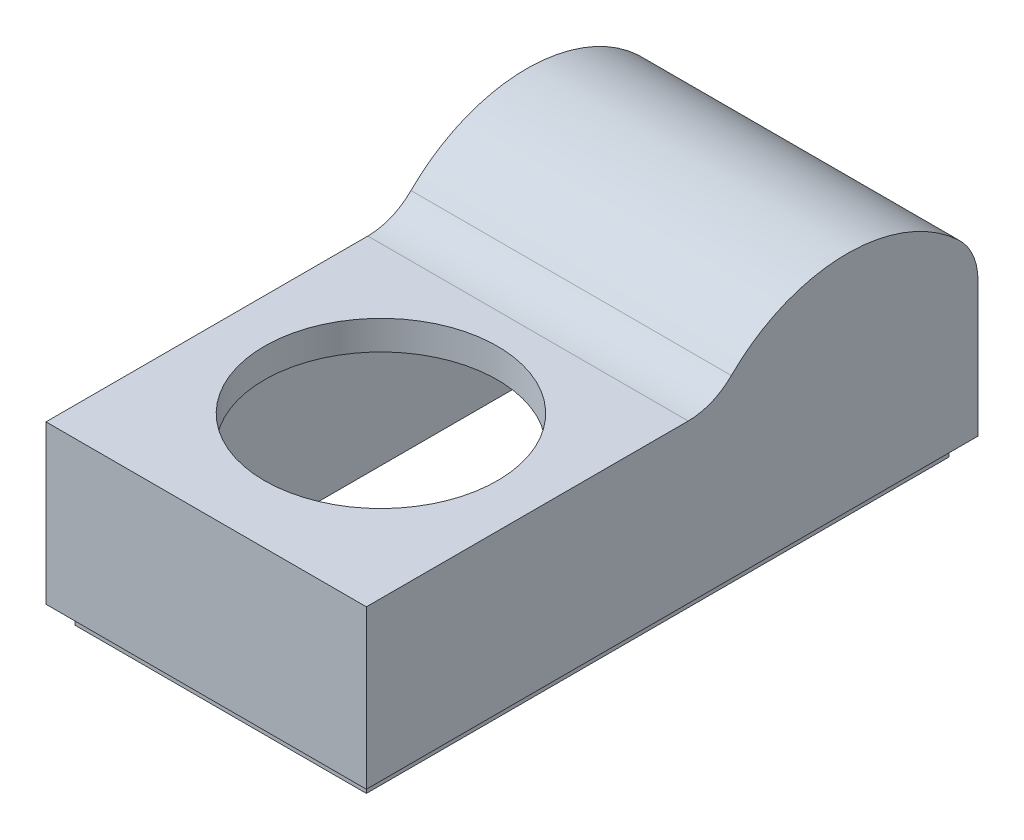
from build123d import *

# Parameters (mm, degrees)
SKETCH1_W           = 27.94
SKETCH1_H           = 53.34
BOSS_EXTRUDE1_DEPTH = 9.74725
CUT_EXTRUDE1_DEPTH  = 27.94
FILLET1_R           = 5.334
FILLET2_R           = 5.334
SHELL1_T            = -2.54
SKETCH3_R           = 10.16
CUT_EXTRUDE2_DEPTH  = 24.13
SKETCH5_W           = 10.795
SKETCH5_H           = 1.5875
CUT_EXTRUDE3_DEPTH  = 2.54
BOSS_EXTRUDE2_DEPTH = 1.5875


with BuildPart() as part:
    # Sketch1 → Boss-Extrude1 (new, symmetric)
    with BuildSketch(Plane(origin=(0, 0, 0), x_dir=(1, 0, 0), z_dir=(0, 1, 0))):
        Rectangle(SKETCH1_W, SKETCH1_H)
    extrude(amount=BOSS_EXTRUDE1_DEPTH, both=True)

    # Sketch2 → Cut-Extrude1 (cut)
    with BuildSketch(Plane(origin=(13.97, 0, 0), x_dir=(0, 0, -1), z_dir=(1, 0, 0))):
        with BuildLine():
            Line((-26.67, 9.74725), (-26.67, 4.03225))
            Line((-26.67, 4.03225), (3.81, 4.03225))
            ThreePointArc((3.81, 4.03225), (8.850435754, 8.238878491), (15.24, 9.74725))
            Line((15.24, 9.74725), (-26.67, 9.74725))
        make_face()
        with BuildLine():
            Line((26.67, 9.74725), (15.24, 9.74725))
            ThreePointArc((15.24, 9.74725), (21.629564246, 8.238878491), (26.67, 4.03225))
            Line((26.67, 4.03225), (26.67, 9.74725))
        make_face()
    extrude(amount=-CUT_EXTRUDE1_DEPTH, mode=Mode.SUBTRACT)

    # Fillet1
    fillet1_edges = [part.edges().sort_by_distance(p)[0] for p in [
        (0, 4.03225, -3.81),
    ]]
    fillet(fillet1_edges, radius=FILLET1_R)

    # Fillet2
    fillet2_edges = [part.edges().sort_by_distance(p)[0] for p in [
        (0, 4.03225, -26.67),
    ]]
    fillet(fillet2_edges, radius=FILLET2_R)

    # Shell1
    shell1_openings = [part.faces().sort_by_distance(p)[0] for p in [
        (0, -9.74725, 0),
    ]]
    offset(amount=SHELL1_T, openings=shell1_openings, kind=Kind.INTERSECTION)

    # Sketch3 → Cut-Extrude2 (cut)
    with BuildSketch(Plane(origin=(0, 4.03225, 0), x_dir=(1, 0, 0), z_dir=(0, 1, 0))):
        with Locations(Location((0, -11.43, 0), (0, 0, 270))):
            Circle(SKETCH3_R)
    extrude(amount=-CUT_EXTRUDE2_DEPTH, mode=Mode.SUBTRACT)

    # Sketch5 → Cut-Extrude3 (cut)
    with BuildSketch(Plane(origin=(0, 0, -26.67), x_dir=(-1, 0, 0), z_dir=(0, 0, -1))):
        with Locations((0, -8.9535)):
            Rectangle(SKETCH5_W, SKETCH5_H)
    extrude(amount=-CUT_EXTRUDE3_DEPTH, mode=Mode.SUBTRACT)

    # Sketch4 → Boss-Extrude2 (add)
    with BuildSketch(Plane.XZ.offset(9.74725)):
        Polygon((-5.3975, -24.13), (-11.43, -24.13), (-11.43, 24.13), (11.43, 24.13), (11.43, -24.13), (5.3975, -24.13), (5.3975, -25.4), (12.7, -25.4), (12.7, 25.4), (-12.7, 25.4), (-12.7, -25.4), (-5.3975, -25.4), align=None)
    extrude(amount=BOSS_EXTRUDE2_DEPTH)


solid = part.part
